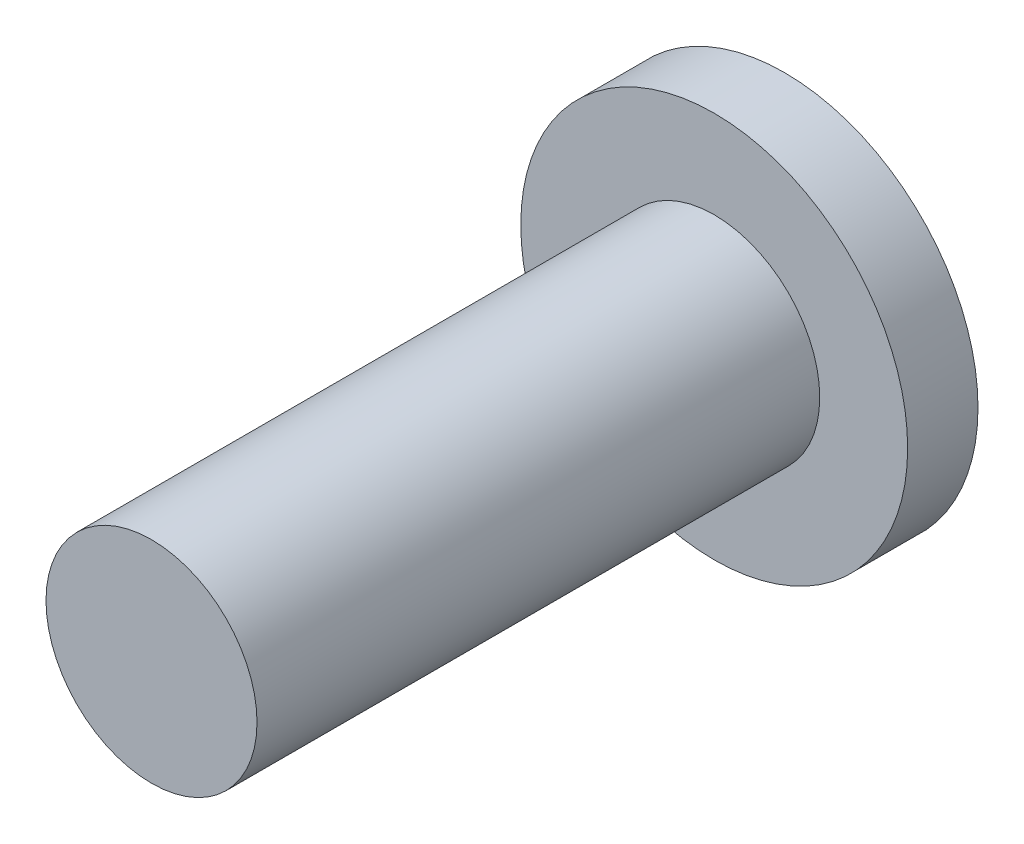
from build123d import *

# Parameters (mm, degrees)
SKETCH_1_R          = 2.75
EXTRUDE_1_DEPTH     = 1
SKETCH_2_R          = 1.5
EXTRUDE_2_DEPTH     = 8
SKETCH_3_W          = 1
SKETCH_3_H          = 1
CUT_EXTRUDE_1_DEPTH = 0.5


with BuildPart() as part:
    # ｽｹｯﾁ1 → ﾎﾞｽ - 押し出し1 (new body)
    with BuildSketch(Plane.XY):
        Circle(SKETCH_1_R)
    extrude(amount=EXTRUDE_1_DEPTH)

    # ｽｹｯﾁ2 → ﾎﾞｽ - 押し出し2 (add)
    with BuildSketch(Plane.XY.offset(1)):
        Circle(SKETCH_2_R)
    extrude(amount=EXTRUDE_2_DEPTH)

    # ｽｹｯﾁ3 → ｶｯﾄ - 押し出し1 (cut)
    with BuildSketch(Plane(origin=(0, 0, 0), x_dir=(-1, 0, 0), z_dir=(0, 0, -1))):
        with Locations((0, 1)):
            Rectangle(SKETCH_3_W, SKETCH_3_H)
        Rectangle(SKETCH_3_W, SKETCH_3_H)
        with Locations((1, 0)):
            Rectangle(SKETCH_3_W, SKETCH_3_H)
        with Locations((-1, 0)):
            Rectangle(SKETCH_3_W, SKETCH_3_H)
        with Locations((0, -1)):
            Rectangle(SKETCH_3_W, SKETCH_3_H)
    extrude(amount=-CUT_EXTRUDE_1_DEPTH, mode=Mode.SUBTRACT)


solid = part.part
